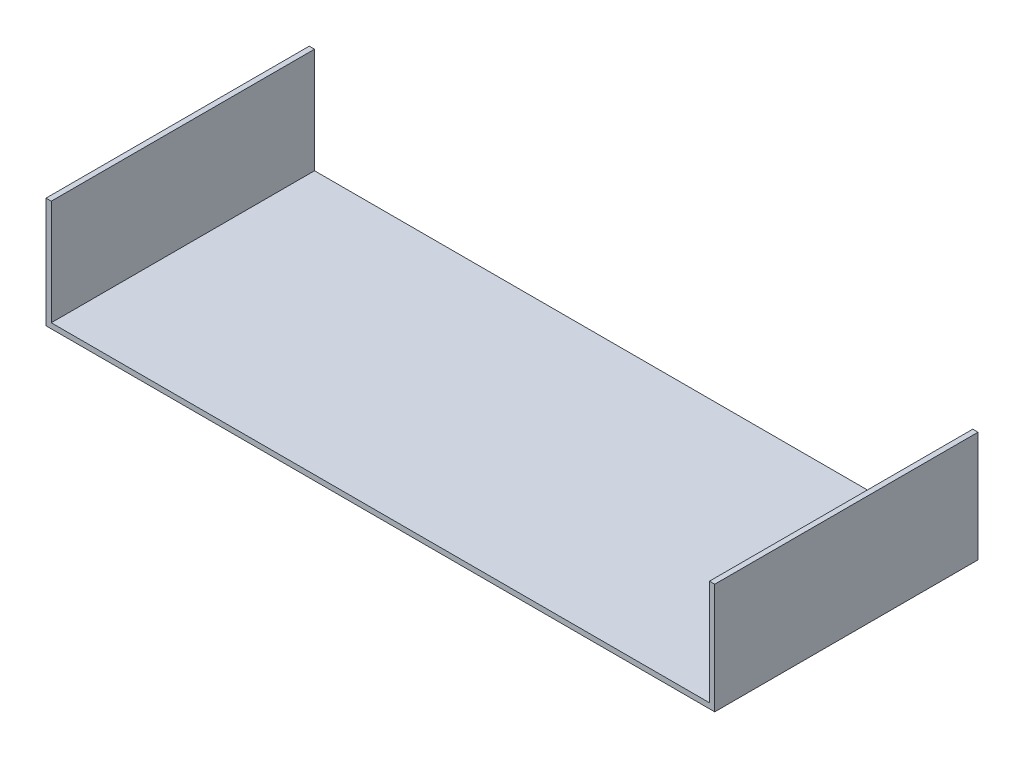
from build123d import *

# Parameters (mm, degrees)
BOSS_EXTRUDE1_DEPTH = 10000


with BuildPart() as part:
    # Sketch1 → Boss-Extrude1 (new body)
    with BuildSketch(Plane.XY):
        Polygon((0, 0), (0, -4000), (25000, -4000), (25000, 0), (25200, 0), (25200, -4200), (-200, -4200), (-200, 0), align=None)
    extrude(amount=BOSS_EXTRUDE1_DEPTH)


solid = part.part
